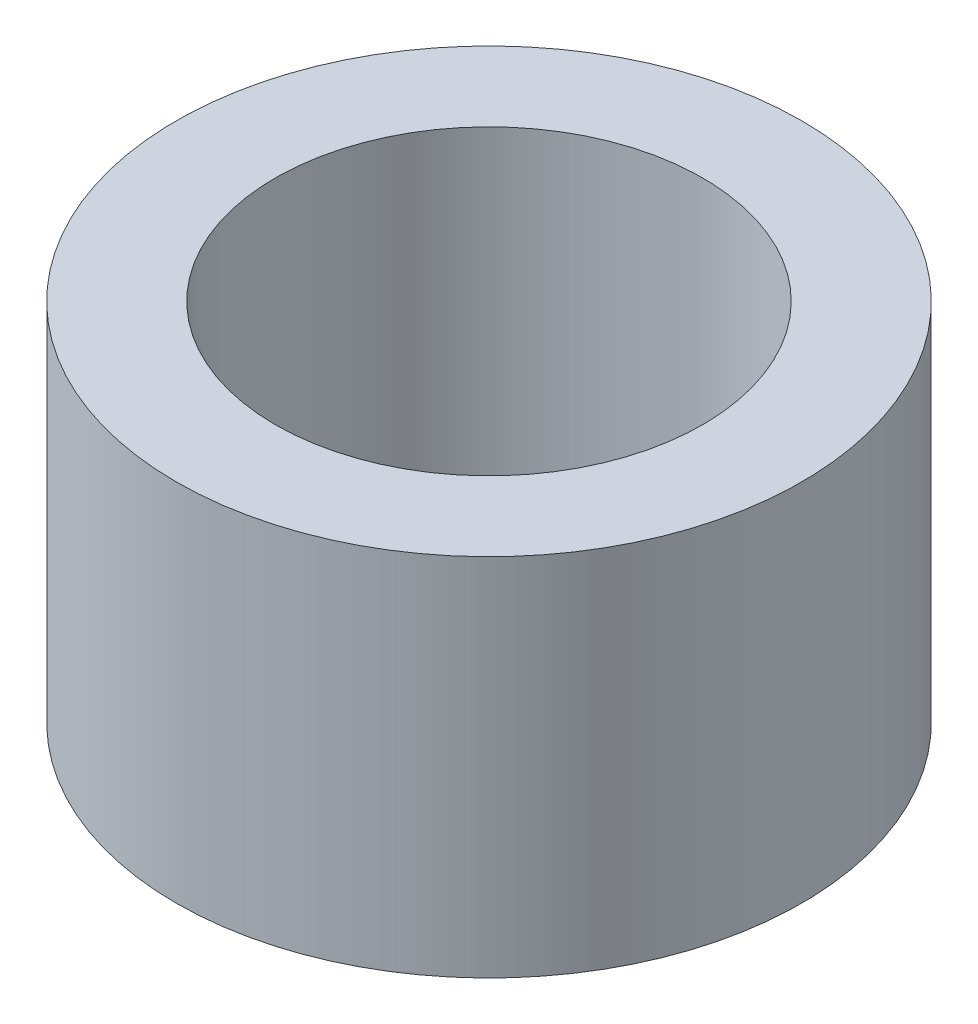
from build123d import *

# Parameters (mm, degrees)
SKETCH1_R           = 6
SKETCH1_R_2         = 4.1
BOSS_EXTRUDE1_DEPTH = 7


with BuildPart() as part:
    # Sketch1 → Boss-Extrude1 (new body)
    with BuildSketch(Plane(origin=(0, 0, 0), x_dir=(1, 0, 0), z_dir=(0, 1, 0))):
        with Locations(Location((0, 0, 0), (0, 0, 270))):
            Circle(SKETCH1_R)
        with Locations(Location((0, 0, 0), (0, 0, 270))):
            Circle(SKETCH1_R_2, mode=Mode.SUBTRACT)
    extrude(amount=BOSS_EXTRUDE1_DEPTH)


solid = part.part
